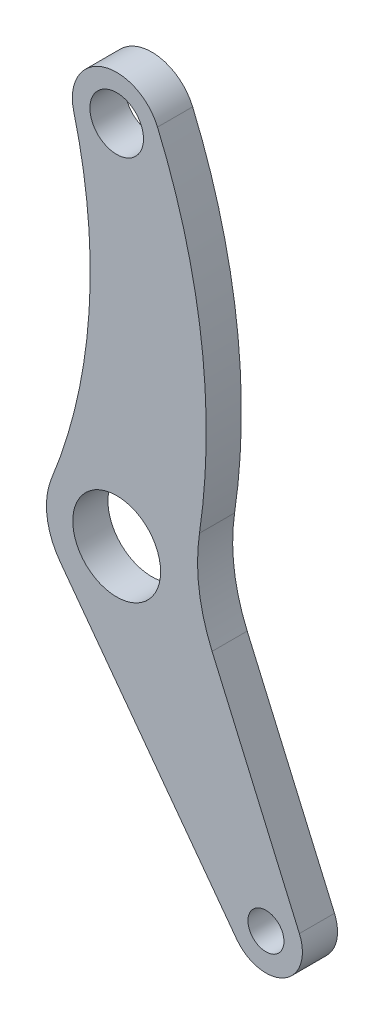
from build123d import *
from build123d.topology import SkipClean

# Parameters (mm, degrees)
SKETCH_1_R          = 1.525
SKETCH_1_R_2        = 1.025
SKETCH_1_R_3        = 2.5
EXTRUDE_1_DEPTH     = 2
CUT_EXTRUDE_START   = -10
CUT_EXTRUDE_1_DEPTH = 10
EXTRUDE_START       = -2
EXTRUDE_2_DEPTH     = 2
FILLET_1_R          = 10


with BuildPart() as part:
    # 草图1 → 凸台-拉伸1 (new body)
    with BuildSketch(Plane.XY):
        with BuildLine():
            Line((-2.51867373, 21.028627098), (-3.989978187, 0.282973621))
            ThreePointArc((-3.989978187, 0.282973621), (-3.84073462, -1.117478224), (-3.215350618, -2.379394965))
            Line((-3.215350618, -2.379394965), (6.832036867, -15.956743003))
            ThreePointArc((6.832036867, -15.956743003), (9.5375, -16.519434577), (10.402926369, -13.895088987))
            Line((10.402926369, -13.895088987), (3.941503233, 0.966479061))
            Line((3.941503233, 0.966479061), (2.51867373, 21.028627098))
            ThreePointArc((2.51867373, 21.028627098), (0, 23.375), (-2.51867373, 21.028627098))
        make_face()
        with Locations((0, 20.85)):
            Circle(SKETCH_1_R, mode=Mode.SUBTRACT)
        with Locations((8.5, -14.722431864)):
            Circle(SKETCH_1_R_2, mode=Mode.SUBTRACT)
        Circle(SKETCH_1_R_3, mode=Mode.SUBTRACT)
    extrude(amount=EXTRUDE_1_DEPTH)

    # 草图2 → 切除-拉伸1 (cut)
    with SkipClean():  # the faces are left unmerged after this step: merging them gives an invalid solid
        with BuildSketch(Plane.XY.offset(2).offset(CUT_EXTRUDE_START)):
            with BuildLine():
                Line((-2.51867373, 21.028627098), (-3.989978187, 0.282973621))
                ThreePointArc((-3.989978187, 0.282973621), (-3.896440427, 0.904296412), (-3.706760113, 1.503306179))
                ThreePointArc((-3.706760113, 1.503306179), (-1.57526628, 10.762235027), (-2.446005808, 20.22335769))
                ThreePointArc((-2.446005808, 20.22335769), (-2.514781389, 20.623064846), (-2.51867373, 21.028627098))
            make_face()
        extrude(amount=CUT_EXTRUDE_1_DEPTH, mode=Mode.SUBTRACT)

    # 草图3 → 凸台-拉伸2 (add)
    with SkipClean():  # the faces are left unmerged after this step: merging them gives an invalid solid
        with BuildSketch(Plane.XY.offset(2).offset(EXTRUDE_START)):
            with BuildLine():
                Line((0, 4), (0, 18.325))
                ThreePointArc((0, 18.325), (2.105124017, 19.455698069), (2.324893847, 21.835136337))
                ThreePointArc((2.324893847, 21.835136337), (5.020381454, 10.519043648), (3.858239677, -1.055455635))
                ThreePointArc((3.858239677, -1.055455635), (3.179765914, 2.426744471), (0, 4))
            make_face()
        extrude(amount=EXTRUDE_2_DEPTH)

    # 圆角1
    fillet_1_edges = [part.edges().sort_by_distance(p)[0] for p in [
        (4.210891787, 0.346873093, 1),
    ]]
    fillet(fillet_1_edges, radius=FILLET_1_R)


solid = part.part
